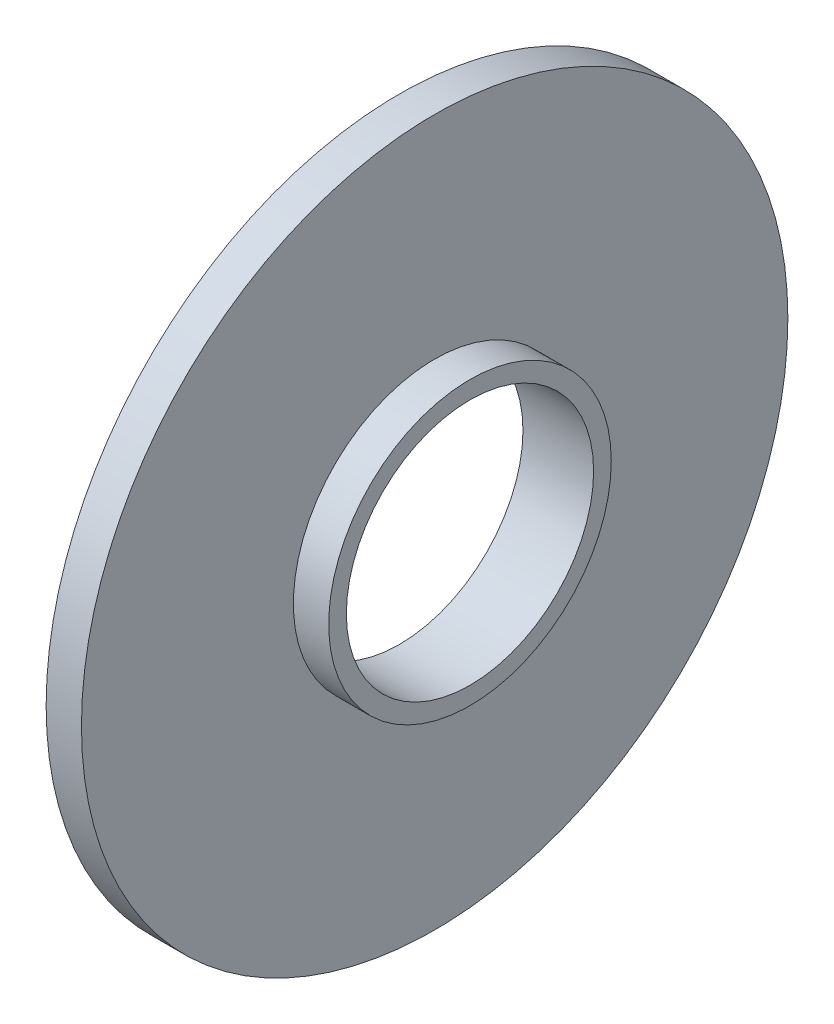
from build123d import *

# Parameters (mm, degrees)
SKETCH1_R           = 10
SKETCH1_R_2         = 3.5
BOSS_EXTRUDE1_DEPTH = 1
SKETCH2_R           = 4
SKETCH2_R_2         = 3.5
BOSS_EXTRUDE2_DEPTH = 1


with BuildPart() as part:
    # Sketch1 → Boss-Extrude1 (new body)
    with BuildSketch(Plane(origin=(0, 0, 0), x_dir=(0, 0, -1), z_dir=(1, 0, 0))):
        Circle(SKETCH1_R)
        Circle(SKETCH1_R_2, mode=Mode.SUBTRACT)
    extrude(amount=BOSS_EXTRUDE1_DEPTH)

    # Sketch2 → Boss-Extrude2 (add)
    with BuildSketch(Plane(origin=(1, 0, 0), x_dir=(0, 0, -1), z_dir=(1, 0, 0))):
        Circle(SKETCH2_R)
        Circle(SKETCH2_R_2, mode=Mode.SUBTRACT)
    extrude(amount=BOSS_EXTRUDE2_DEPTH)


solid = part.part
